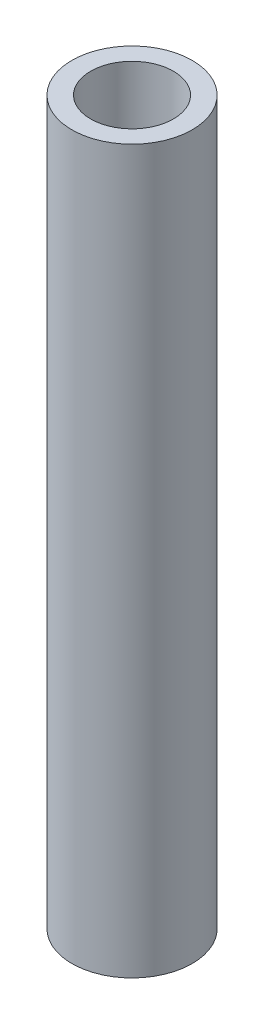
from build123d import *

# Parameters (mm, degrees)
SKETCH1_R             = 1.5875
BOSS_EXTRUDE1_DEPTH   = 19.05
F_2_56_TAPPED_HOLE1_D = 2.1844


with BuildPart() as part:
    # Sketch1 → Boss-Extrude1 (new body)
    with BuildSketch(Plane(origin=(0, 0, 0), x_dir=(1, 0, 0), z_dir=(0, 1, 0))):
        with Locations(Location((0, 0, 0), (0, 0, 90))):
            Circle(SKETCH1_R)
    extrude(amount=BOSS_EXTRUDE1_DEPTH)

    # #2-56 Tapped Hole1 (through all)
    with Locations(Plane(origin=(0, 19.05, 0), x_dir=(1, 0, 0), z_dir=(0, 1, 0))):
        with Locations((0, 0)):
            Hole(F_2_56_TAPPED_HOLE1_D / 2)


solid = part.part
